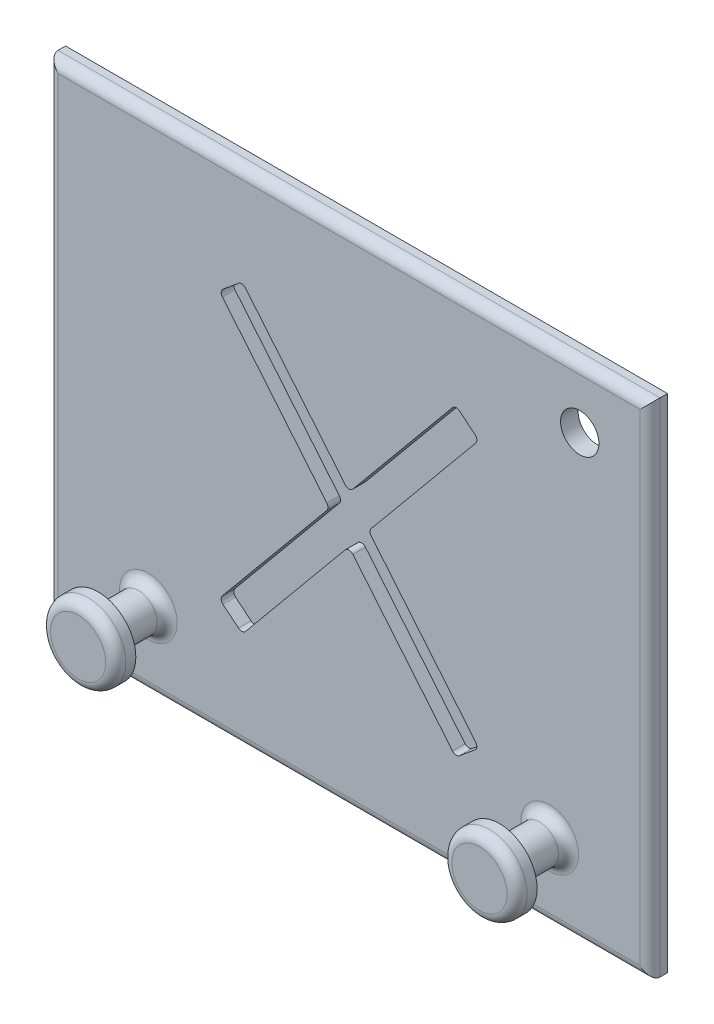
from build123d import *

# Parameters (mm, degrees)
SKETCH1_W           = 120
SKETCH1_H           = 100
BOSS_EXTRUDE1_DEPTH = 3.5
SKETCH9_R           = 3.825
CUT_EXTRUDE4_DEPTH  = 4
FILLET1_R           = 2
SKETCH10_R          = 3.75
BOSS_EXTRUDE4_DEPTH = 10
SKETCH11_R          = 7.5
BOSS_EXTRUDE5_DEPTH = 4
SKETCH12_R          = 7.5
BOSS_EXTRUDE6_DEPTH = 4
FILLET2_R           = 2
CUT_EXTRUDE9_DEPTH  = 2.5
FILLET3_R           = 1


with BuildPart() as part:
    # Sketch1 → Boss-Extrude1 (new body)
    with BuildSketch(Plane.XY):
        Rectangle(SKETCH1_W, SKETCH1_H)
    extrude(amount=BOSS_EXTRUDE1_DEPTH)

    # Sketch9 → Cut-Extrude4 (cut)
    with BuildSketch(Plane.XY.offset(3.5)):
        with Locations((46, 38)):
            Circle(SKETCH9_R)
    extrude(amount=-CUT_EXTRUDE4_DEPTH, mode=Mode.SUBTRACT)

    # Fillet1
    fillet1_edges = [part.edges().sort_by_distance(p)[0] for p in [
        (-60, 0, 3.5),
        (0, -50, 3.5),
        (60, 0, 3.5),
        (0, 50, 3.5),
    ]]
    fillet(fillet1_edges, radius=FILLET1_R)

    # Sketch10 → Boss-Extrude4 (add)
    with BuildSketch(Plane.XY.offset(3.5)):
        with Locations(Location((-40, -35, 0), (0, 0, 180))):
            Circle(SKETCH10_R)
        with Locations(Location((40, -35, 0), (0, 0, 180))):
            Circle(SKETCH10_R)
    extrude(amount=BOSS_EXTRUDE4_DEPTH)

    # Sketch11 → Boss-Extrude5 (add)
    with BuildSketch(Plane.XY.offset(13.5)):
        with Locations((-40, -35)):
            Circle(SKETCH11_R)
    extrude(amount=BOSS_EXTRUDE5_DEPTH)

    # Sketch12 → Boss-Extrude6 (add)
    with BuildSketch(Plane.XY.offset(13.5)):
        with Locations((40, -35)):
            Circle(SKETCH12_R)
    extrude(amount=BOSS_EXTRUDE6_DEPTH)

    # Fillet2
    fillet2_edges = [part.edges().sort_by_distance(p)[0] for p in [
        (-36.25, -35, 3.5),
        (43.75, -35, 3.5),
        (43.75, -35, 13.5),
        (-47.5, -35, 17.5),
        (32.5, -35, 17.5),
    ]]
    fillet(fillet2_edges, radius=FILLET2_R)

    # Sketch19 → Cut-Extrude9 (cut)
    with BuildSketch(Plane.XY.offset(3.5)):
        Polygon((-21.265387255, -30.401058823), (-25.887753182, -26.575652539), (-3.894109616, 1.04e-07), (-25.887751659, 26.575653799), (-21.265385732, 30.401060083), (1.26e-07, 4.705382708), (21.265387255, 30.401058823), (25.887753182, 26.575652539), (3.894109616, -1.04e-07), (25.887751659, -26.575653799), (21.265385732, -30.401060083), (-1.26e-07, -4.705382708), align=None)
    extrude(amount=-CUT_EXTRUDE9_DEPTH, mode=Mode.SUBTRACT)

    # Fillet3
    fillet3_edges = [part.edges().sort_by_distance(p)[0] for p in [
        (-3.894109616, 1.04e-07, 2.25),
        (-25.887751659, 26.575653799, 2.25),
        (-21.265385732, 30.401060083, 2.25),
        (1.26e-07, 4.705382708, 2.25),
        (21.265387255, 30.401058823, 2.25),
        (25.887753182, 26.575652539, 2.25),
        (3.894109616, -1.04e-07, 2.25),
        (25.887751659, -26.575653799, 2.25),
        (21.265385732, -30.401060083, 2.25),
        (-1.26e-07, -4.705382708, 2.25),
        (-21.265387255, -30.401058823, 2.25),
        (-25.887753182, -26.575652539, 2.25),
    ]]
    fillet(fillet3_edges, radius=FILLET3_R)


solid = part.part
